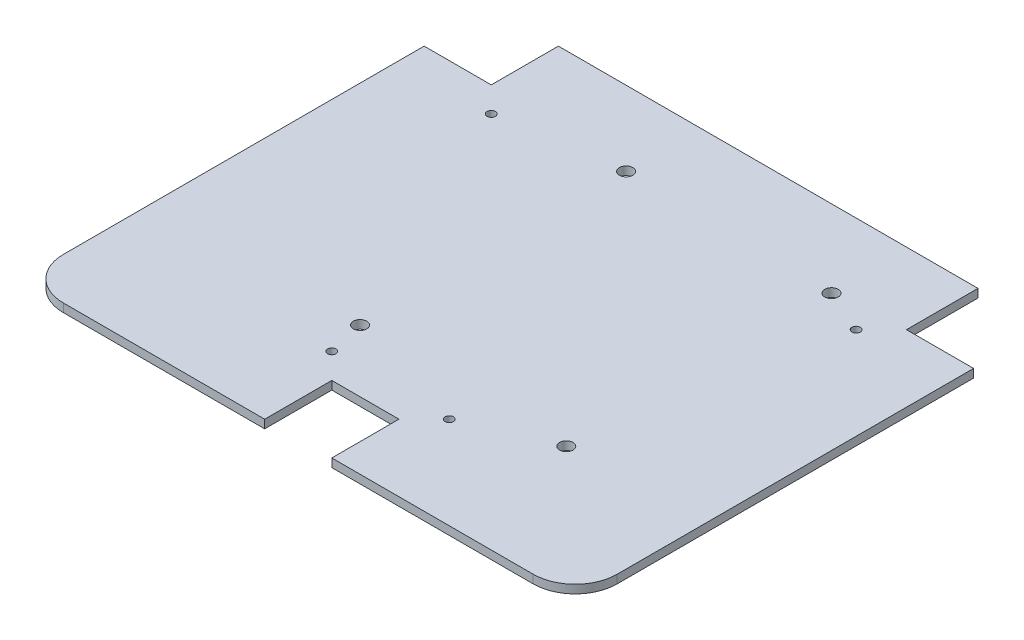
from build123d import *

# Parameters (mm, degrees)
RESSALTO_EXTRUS_O4_DEPTH = 5
ESBO_O2_R                = 2.5
CORTE_EXTRUS_O1_DEPTH    = 5
ESBO_O3_R                = 4
CORTE_EXTRUS_O2_DEPTH    = 5


with BuildPart() as part:
    # Esboço1 → Ressalto-extrusão4 (new body)
    with BuildSketch(Plane(origin=(0, 0, 0), x_dir=(1, 0, 0), z_dir=(0, 1, 0))):
        with BuildLine():
            Line((504.267355398, -155.796995794), (384.267355398, -155.796995794))
            ThreePointArc((384.267355398, -155.796995794), (366.589685869, -148.474665324), (359.267355398, -130.796995794))
            Line((359.267355398, -130.796995794), (359.267355398, 84.203004206))
            Line((359.267355398, 84.203004206), (399.267355398, 84.203004206))
            Line((399.267355398, 84.203004206), (399.267355398, 124.203004206))
            Line((399.267355398, 124.203004206), (649.267355398, 124.203004206))
            Line((649.267355398, 124.203004206), (649.267355398, 81.588187759))
            Line((649.267355398, 81.588187759), (689.267355398, 81.588187759))
            Line((689.267355398, 81.588187759), (689.267355398, -130.796995794))
            ThreePointArc((689.267355398, -130.796995794), (681.945024928, -148.474665324), (664.267355398, -155.796995794))
            Line((664.267355398, -155.796995794), (544.267355398, -155.796995794))
            Line((544.267355398, -155.796995794), (544.267355398, -115.796995794))
            Line((544.267355398, -115.796995794), (504.267355398, -115.796995794))
            Line((504.267355398, -115.796995794), (504.267355398, -155.796995794))
        make_face()
    extrude(amount=RESSALTO_EXTRUS_O4_DEPTH)

    # Esboço2 → Corte-extrusão1 (cut)
    with BuildSketch(Plane(origin=(0, 5, 0), x_dir=(1, 0, 0), z_dir=(0, 1, 0))):
        with Locations(Location((559.267355398, -100.796995794, 0), (0, 0, 270))):
            Circle(ESBO_O2_R)
        with Locations(Location((489.267355398, -100.796995794, 0), (0, 0, 270))):
            Circle(ESBO_O2_R)
        with Locations(Location((634.267355398, 66.588187759, 0), (0, 0, 270))):
            Circle(ESBO_O2_R)
        with Locations(Location((414.267355398, 69.203004206, 0), (0, 0, 270))):
            Circle(ESBO_O2_R)
    extrude(amount=-CORTE_EXTRUS_O1_DEPTH, mode=Mode.SUBTRACT)

    # Esboço3 → Corte-extrusão2 (cut)
    with BuildSketch(Plane(origin=(0, 5, 0), x_dir=(1, 0, 0), z_dir=(0, 1, 0))):
        with Locations(Location((608.081782449, -79.913221978, 0), (0, 0, 270))):
            Circle(ESBO_O3_R)
        with Locations(Location((484.081782449, -78.796995794, 0), (0, 0, 270))):
            Circle(ESBO_O3_R)
        with Locations(Location((484.081782449, 79.711850126, 0), (0, 0, 270))):
            Circle(ESBO_O3_R)
        with Locations(Location((608.081782449, 78.086778022, 0), (0, 0, 270))):
            Circle(ESBO_O3_R)
    extrude(amount=-CORTE_EXTRUS_O2_DEPTH, mode=Mode.SUBTRACT)


solid = part.part
